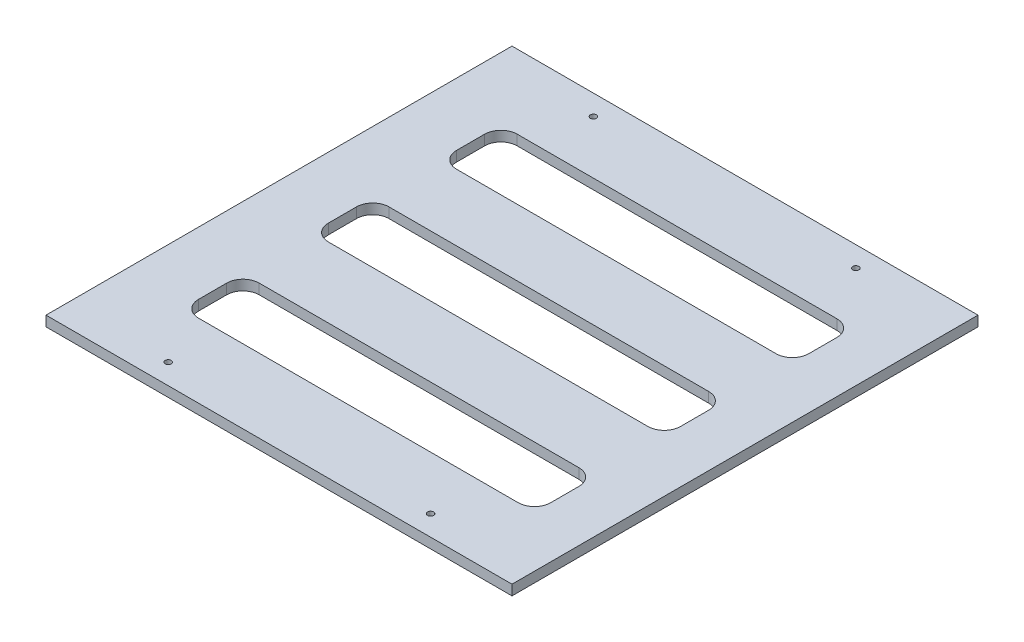
from build123d import *

# Parameters (mm, degrees)
SKETCH1_W           = 229
SKETCH1_H           = 229
SKETCH1_R           = 1.5
BOSS_EXTRUDE1_DEPTH = 5
CUT_EXTRUDE1_DEPTH  = 5


with BuildPart() as part:
    # Sketch1 → Boss-Extrude1 (new body)
    with BuildSketch(Plane(origin=(0, 0, 0), x_dir=(1, 0, 0), z_dir=(0, 1, 0))):
        with Locations((114.5, -114.5)):
            Rectangle(SKETCH1_W, SKETCH1_H)
        with Locations(Location((179, -10, 0), (0, 0, 270))):
            Circle(SKETCH1_R, mode=Mode.SUBTRACT)
        with Locations(Location((50, -10, 0), (0, 0, 90))):
            Circle(SKETCH1_R, mode=Mode.SUBTRACT)
        with Locations(Location((179, -219, 0), (0, 0, 90))):
            Circle(SKETCH1_R, mode=Mode.SUBTRACT)
        with Locations(Location((50, -219, 0), (0, 0, 270))):
            Circle(SKETCH1_R, mode=Mode.SUBTRACT)
    extrude(amount=BOSS_EXTRUDE1_DEPTH)

    # Sketch2 → Cut-Extrude1 (cut)
    with BuildSketch(Plane(origin=(0, 5, 0), x_dir=(1, 0, 0), z_dir=(0, 1, 0))):
        with BuildLine():
            Line((38.760316137, -36.197957946), (195.832686867, -36.197957946))
            ThreePointArc((195.832686867, -36.197957946), (201.489541116, -38.541103697), (203.832686867, -44.197957946))
            Line((203.832686867, -44.197957946), (203.832686867, -58.0273073))
            ThreePointArc((203.832686867, -58.0273073), (201.489541116, -63.68416155), (195.832686867, -66.0273073))
            Line((195.832686867, -66.0273073), (38.760316137, -66.0273073))
            ThreePointArc((38.760316137, -66.0273073), (33.103461887, -63.68416155), (30.760316137, -58.0273073))
            Line((30.760316137, -58.0273073), (30.760316137, -44.197957946))
            ThreePointArc((30.760316137, -44.197957946), (33.103461887, -38.541103697), (38.760316137, -36.197957946))
        make_face()
        with BuildLine():
            Line((203.832686867, -184.802042054), (203.832686867, -170.9726927))
            ThreePointArc((203.832686867, -170.9726927), (201.489541116, -165.31583845), (195.832686867, -162.9726927))
            Line((195.832686867, -162.9726927), (38.760316137, -162.9726927))
            ThreePointArc((38.760316137, -162.9726927), (33.103461887, -165.31583845), (30.760316137, -170.9726927))
            Line((30.760316137, -170.9726927), (30.760316137, -184.802042054))
            ThreePointArc((30.760316137, -184.802042054), (33.103461887, -190.458896303), (38.760316137, -192.802042054))
            Line((38.760316137, -192.802042054), (195.832686867, -192.802042054))
            ThreePointArc((195.832686867, -192.802042054), (201.489541116, -190.458896303), (203.832686867, -184.802042054))
        make_face()
        with BuildLine():
            Line((38.22, -98.653158156), (195.29, -98.653158156))
            ThreePointArc((195.29, -98.653158156), (200.946854249, -100.996303906), (203.29, -106.653158156))
            Line((203.29, -106.653158156), (203.29, -120.48250751))
            ThreePointArc((203.29, -120.48250751), (200.946854249, -126.139361759), (195.29, -128.48250751))
            Line((195.29, -128.48250751), (38.22, -128.48250751))
            ThreePointArc((38.22, -128.48250751), (32.563145751, -126.139361759), (30.22, -120.48250751))
            Line((30.22, -120.48250751), (30.22, -106.653158156))
            ThreePointArc((30.22, -106.653158156), (32.563145751, -100.996303906), (38.22, -98.653158156))
        make_face()
    extrude(amount=-CUT_EXTRUDE1_DEPTH, mode=Mode.SUBTRACT)


solid = part.part
